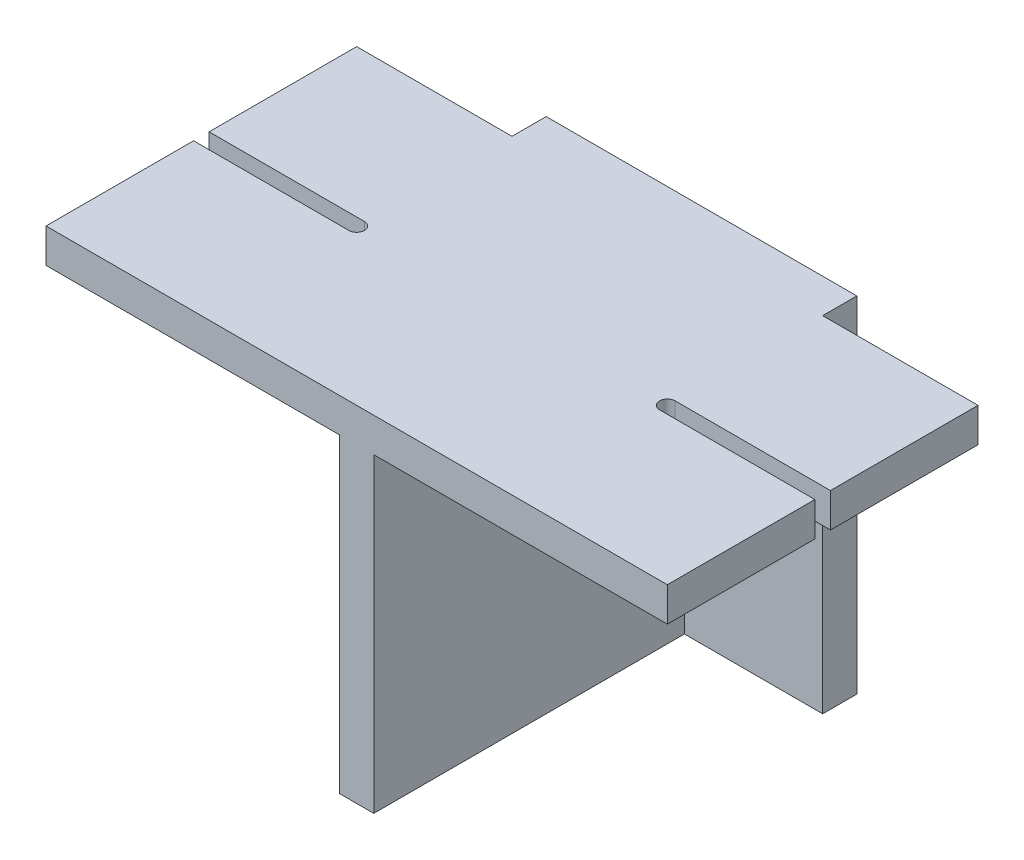
from build123d import *

# Parameters (mm, degrees)
BOSS_EXTRU_1_DEPTH = 22
ESQUISSE2_W        = 22
ESQUISSE2_H        = 200
BOSS_EXTRU_2_DEPTH = 200
ESQUISSE3_W        = 200
ESQUISSE3_H        = 22
BOSS_EXTRU_3_DEPTH = 222


with BuildPart() as part:
    # Esquisse1 → Boss.-Extru.1 (new body)
    with BuildSketch(Plane(origin=(0, 0, 0), x_dir=(1, 0, 0), z_dir=(0, 1, 0))):
        with BuildLine():
            Line((0, 0), (0, -200))
            Line((0, -200), (-200, -200))
            Line((-200, -200), (-200, -105))
            Line((-200, -105), (-100, -105))
            ThreePointArc((-100, -105), (-95, -100), (-100, -95))
            Line((-100, -95), (-200, -95))
            Line((-200, -95), (-200, 0))
            Line((-200, 0), (0, 0))
        make_face()
    boss_extru_1 = extrude(amount=BOSS_EXTRU_1_DEPTH)

    # Symétrie1: Boss.-Extru.1 across plane
    add(boss_extru_1.mirror(Plane(origin=(0, 22, 0), x_dir=(0, 0, 1), z_dir=(-1, 0, 0))))

    # Esquisse2 → Boss.-Extru.2 (add)
    with BuildSketch(Plane.XZ):
        with Locations((0, 100)):
            Rectangle(ESQUISSE2_W, ESQUISSE2_H)
    extrude(amount=BOSS_EXTRU_2_DEPTH)

    # Esquisse3 → Boss.-Extru.3 (add)
    with BuildSketch(Plane(origin=(0, 22, 0), x_dir=(1, 0, 0), z_dir=(0, 1, 0))):
        with Locations((0, 11)):
            Rectangle(ESQUISSE3_W, ESQUISSE3_H)
    extrude(amount=-BOSS_EXTRU_3_DEPTH)


solid = part.part
